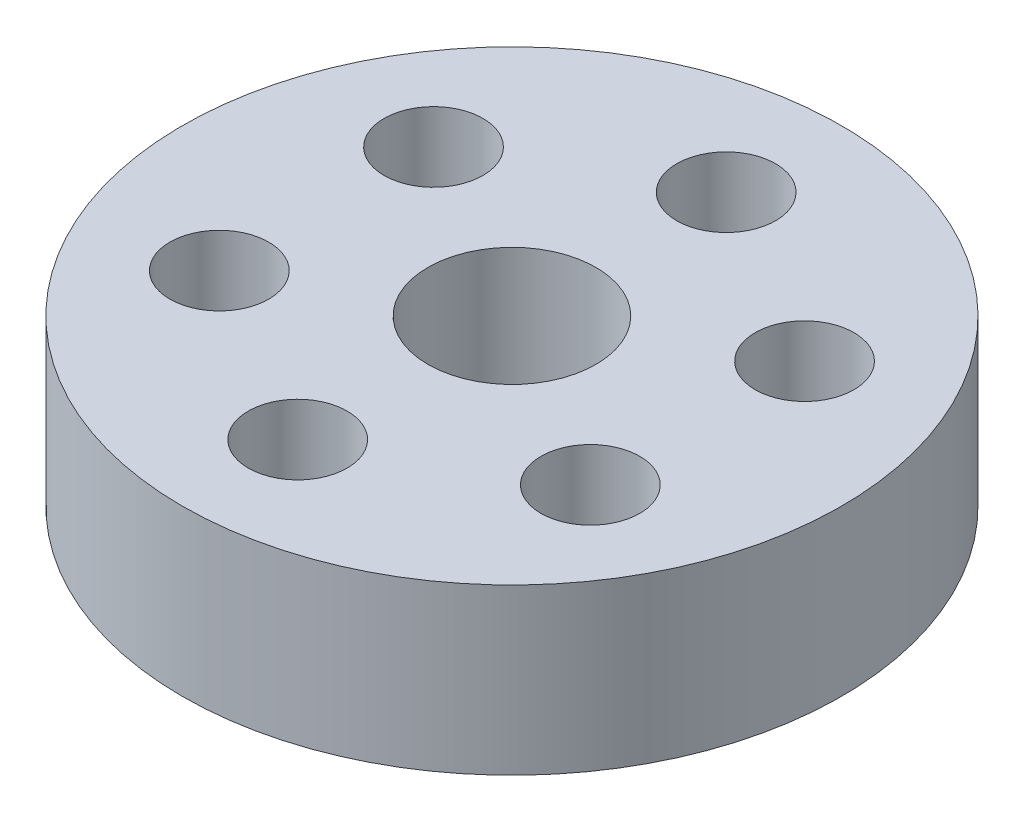
from build123d import *

# Parameters (mm, degrees)
SKETCH1_R   = 12.7
SKETCH1_R_2 = 1.905
SKETCH1_R_3 = 3.2385
BASE_DEPTH  = 6.35


with BuildPart() as part:
    # Sketch1 → base (new body)
    with BuildSketch(Plane(origin=(0, 0, 0), x_dir=(1, 0, 0), z_dir=(0, 1, 0))):
        with Locations(Location((0, 0, 0), (0, 0, 270))):
            Circle(SKETCH1_R)
        with Locations(Location((0, 8.255, 0), (0, 0, 270))):
            Circle(SKETCH1_R_2, mode=Mode.SUBTRACT)
        with Locations(Location((0, 0, 0), (0, 0, 270))):
            Circle(SKETCH1_R_3, mode=Mode.SUBTRACT)
        with Locations(Location((7.149039708, 4.1275, 0), (0, 0, 270))):
            Circle(SKETCH1_R_2, mode=Mode.SUBTRACT)
        with Locations(Location((7.149039708, -4.1275, 0), (0, 0, 270))):
            Circle(SKETCH1_R_2, mode=Mode.SUBTRACT)
        with Locations(Location((0, -8.255, 0), (0, 0, 270))):
            Circle(SKETCH1_R_2, mode=Mode.SUBTRACT)
        with Locations(Location((-7.149039708, -4.1275, 0), (0, 0, 270))):
            Circle(SKETCH1_R_2, mode=Mode.SUBTRACT)
        with Locations(Location((-7.149039708, 4.1275, 0), (0, 0, 270))):
            Circle(SKETCH1_R_2, mode=Mode.SUBTRACT)
    extrude(amount=BASE_DEPTH)


solid = part.part
